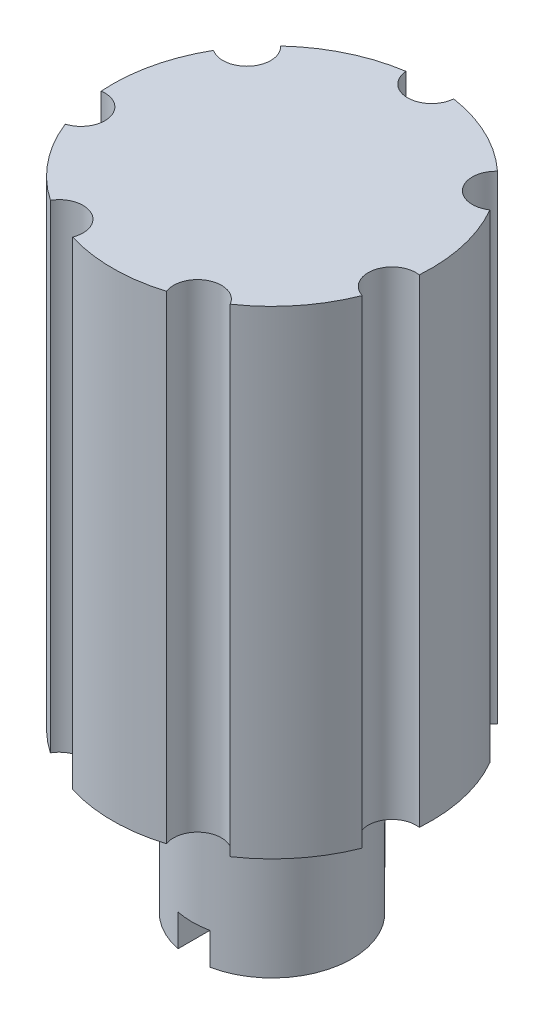
from build123d import *

# Parameters (mm, degrees)
SKETCH2_R           = 2.5
BOSS_EXTRUDE1_DEPTH = 5
SKETCH3_R           = 5
BOSS_EXTRUDE2_DEPTH = 15
SKETCH4_R           = 0.75
CUT_EXTRUDE1_DEPTH  = 15
SKETCH5_R           = 1.25
CUT_EXTRUDE2_DEPTH  = 1
CUT_EXTRUDE3_DEPTH  = 1


with BuildPart() as part:
    # Sketch2 → Boss-Extrude1 (new body)
    with BuildSketch(Plane(origin=(0, 0, 0), x_dir=(1, 0, 0), z_dir=(0, 1, 0))):
        with Locations(Location((0, 0, 0), (0, 0, 270))):
            Circle(SKETCH2_R)
    extrude(amount=BOSS_EXTRUDE1_DEPTH)

    # Sketch3 → Boss-Extrude2 (add)
    with BuildSketch(Plane(origin=(0, 5, 0), x_dir=(1, 0, 0), z_dir=(0, 1, 0))):
        with Locations(Location((0, 0, 0), (0, 0, 270))):
            Circle(SKETCH3_R)
    extrude(amount=BOSS_EXTRUDE2_DEPTH)

    # Sketch4 → Cut-Extrude1 (cut)
    with BuildSketch(Plane(origin=(0, 20, 0), x_dir=(1, 0, 0), z_dir=(0, 1, 0))):
        with Locations((0, 5)):
            Circle(SKETCH4_R)
        with Locations((3.909157412, 3.117449009)):
            Circle(SKETCH4_R)
        with Locations((4.874639561, -1.11260467)):
            Circle(SKETCH4_R)
        with Locations((2.169418696, -4.50484434)):
            Circle(SKETCH4_R)
        with Locations((-2.169418696, -4.50484434)):
            Circle(SKETCH4_R)
        with Locations((-4.874639561, -1.11260467)):
            Circle(SKETCH4_R)
        with Locations((-3.909157412, 3.117449009)):
            Circle(SKETCH4_R)
    extrude(amount=-CUT_EXTRUDE1_DEPTH, mode=Mode.SUBTRACT)

    # Sketch5 → Cut-Extrude2 (cut)
    with BuildSketch(Plane.XZ):
        with Locations(Location((0, 0, 0), (0, 0, 270))):
            Circle(SKETCH5_R)
    extrude(amount=-CUT_EXTRUDE2_DEPTH, mode=Mode.SUBTRACT)

    # Sketch6 → Cut-Extrude3 (cut)
    with BuildSketch(Plane.XZ):
        with BuildLine():
            Line((-0.5, 2.449489743), (-0.5, 1.145643924))
            ThreePointArc((-0.5, 1.145643924), (0, 1.25), (0.5, 1.145643924))
            Line((0.5, 1.145643924), (0.5, 2.449489743))
            ThreePointArc((0.5, 2.449489743), (0, 2.5), (-0.5, 2.449489743))
        make_face()
    extrude(amount=-CUT_EXTRUDE3_DEPTH, mode=Mode.SUBTRACT)


solid = part.part
